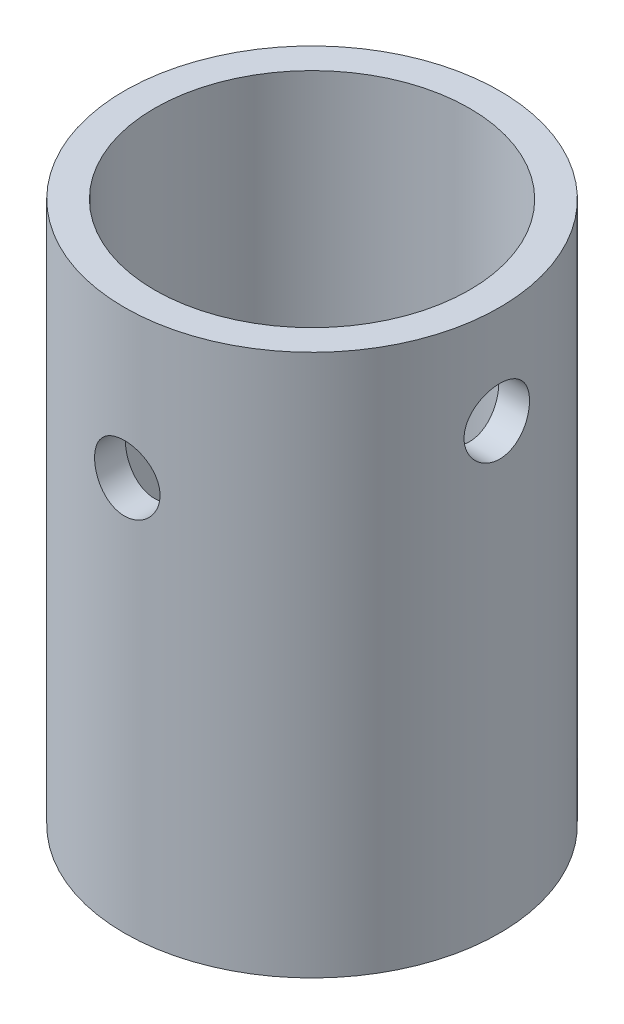
from build123d import *

# Parameters (mm, degrees)
SKETCH1_R           = 24.1681
BOSS_EXTRUDE1_DEPTH = 69.7992
SKETCH2_R           = 20.2819
CUT_EXTRUDE1_DEPTH  = 78.718224606
SKETCH3_R           = 4.2164
CUT_EXTRUDE2_DEPTH  = 69.7992
SKETCH4_R           = 4.2164
CUT_EXTRUDE3_DEPTH  = 69.7992


with BuildPart() as part:
    # Sketch1 → Boss-Extrude1 (new body)
    with BuildSketch(Plane(origin=(0, 0, 0), x_dir=(1, 0, 0), z_dir=(0, 1, 0))):
        with Locations(Location((0, 0, 0), (0, 0, 270))):
            Circle(SKETCH1_R)
    extrude(amount=-BOSS_EXTRUDE1_DEPTH)

    # Sketch2 → Cut-Extrude1 (cut, through all)
    with BuildSketch(Plane(origin=(0, 0, 0), x_dir=(1, 0, 0), z_dir=(0, 1, 0))):
        with Locations(Location((0, 0, 0), (0, 0, 270))):
            Circle(SKETCH2_R)
    extrude(amount=-CUT_EXTRUDE1_DEPTH, mode=Mode.SUBTRACT)

    # Sketch3 → Cut-Extrude2 (cut)
    with BuildSketch(Plane.XY):
        with Locations(Location((0, -19.05, 0), (0, 0, 270))):
            Circle(SKETCH3_R)
    extrude(amount=CUT_EXTRUDE2_DEPTH, mode=Mode.SUBTRACT)

    # Sketch4 → Cut-Extrude3 (cut)
    with BuildSketch(Plane(origin=(0, 0, 0), x_dir=(0, 0, -1), z_dir=(1, 0, 0))):
        with Locations(Location((0, -12.7, 0), (0, 0, 180))):
            Circle(SKETCH4_R)
    extrude(amount=CUT_EXTRUDE3_DEPTH, mode=Mode.SUBTRACT)


solid = part.part
